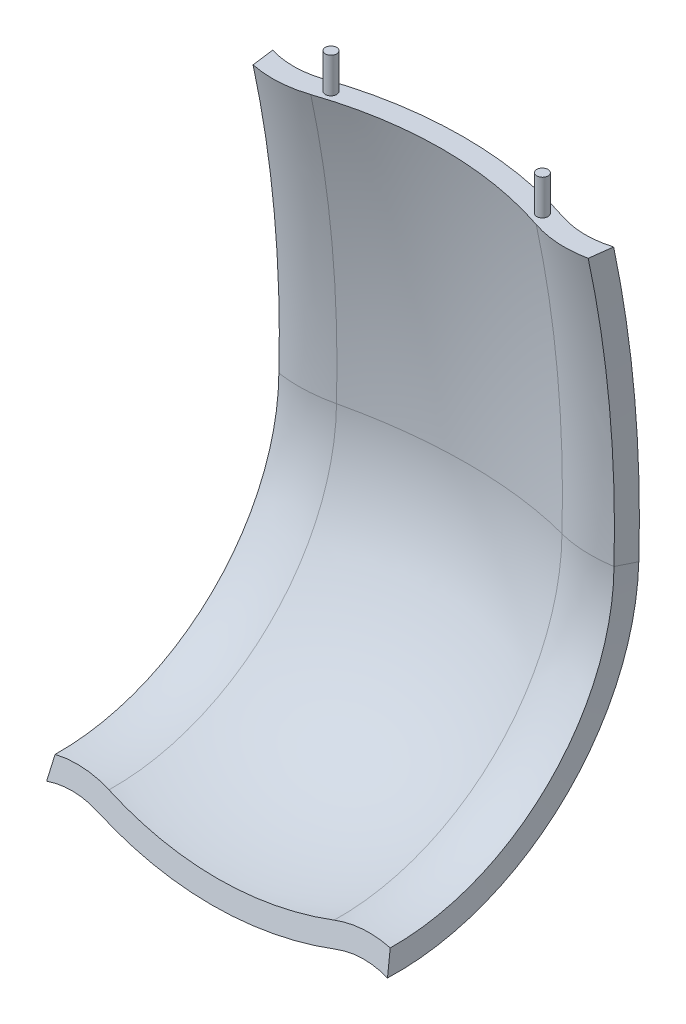
from build123d import *

# Parameters (mm, degrees)
SKETCH4_R           = 4
BOSS_EXTRUDE1_DEPTH = 25


with BuildPart() as part:
    # Sweep1: sweep along a path in Sketch3
    with BuildLine(Plane(origin=(0, 0, 0), x_dir=(0, 0, -1), z_dir=(1, 0, 0))) as sweep1_path:
        ThreePointArc((-156.490372524, -372.309269532), (-29.86748259, -325.839888984), (26.095604491, -203.117061165))
        ThreePointArc((26.095604491, -203.117061165), (23.292710008, -101.028489157), (8.353595888, 0))
    # Sketch2 → Sweep1 (sweep)
    with BuildSketch(Plane(origin=(0, 0, 0), x_dir=(1, 0, 0), z_dir=(0, 1, 0))):
        with BuildLine():
            Line((106.171721078, 4.787075913), (104.135409967, -11.214194161))
            ThreePointArc((104.135409967, -11.214194161), (84.415389077, -12.679452198), (65.003317638, -8.911470313))
            ThreePointArc((65.003317638, -8.911470313), (-14.910313161, 4.148624374), (-94.806270602, -9.019156209))
            ThreePointArc((-94.806270602, -9.019156209), (-114.028080974, -12.687418048), (-133.542450498, -11.230187465))
            Line((-133.542450498, -11.230187465), (-135.591251757, 4.767644245))
            ThreePointArc((-135.591251757, 4.767644245), (-117.558432017, 2.20143547), (-99.592921033, 5.202840203))
            ThreePointArc((-99.592921033, 5.202840203), (-14.910259594, 19.154520277), (69.790065455, 5.310479613))
            ThreePointArc((69.790065455, 5.310479613), (87.939964024, 2.203796687), (106.171721078, 4.787075913))
        make_face()
    sweep(path=sweep1_path.line)

    # Sketch4 → Boss-Extrude1 (add)
    with BuildSketch(Plane(origin=(0, 0, 0), x_dir=(1, 0, 0), z_dir=(0, 1, 0))):
        with Locations(Location((-89.64350233, 0.1407291, 0), (0, 0, 90))):
            Circle(SKETCH4_R)
        with Locations(Location((60.305101164, 0.141223038, 0), (0, 0, 90))):
            Circle(SKETCH4_R)
    extrude(amount=BOSS_EXTRUDE1_DEPTH)


solid = part.part
